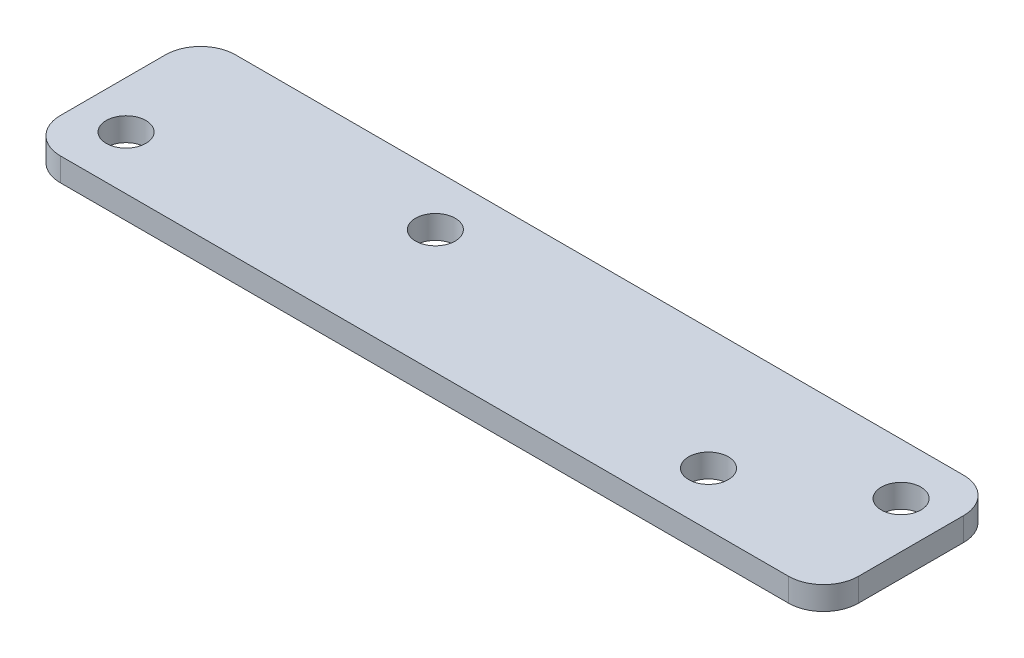
from build123d import *

# Parameters (mm, degrees)
SKETCH_1_R      = 1.7
EXTRUDE_1_DEPTH = 2


with BuildPart() as part:
    # 草图1 → 凸台-拉伸1 (new body)
    with BuildSketch(Plane(origin=(0, 0, 0), x_dir=(1, 0, 0), z_dir=(0, 1, 0))):
        with BuildLine():
            Line((-107.557379254, -1.346413842), (-45.180272198, -1.346413842))
            ThreePointArc((-45.180272198, -1.346413842), (-43.058951854, -2.225093498), (-42.180272198, -4.346413842))
            Line((-42.180272198, -4.346413842), (-42.180272198, -13.346413842))
            ThreePointArc((-42.180272198, -13.346413842), (-43.058951854, -15.467734186), (-45.180272198, -16.346413842))
            Line((-45.180272198, -16.346413842), (-107.557379254, -16.346413842))
            ThreePointArc((-107.557379254, -16.346413842), (-109.678699598, -15.467734186), (-110.557379254, -13.346413842))
            Line((-110.557379254, -13.346413842), (-110.557379254, -4.346413842))
            ThreePointArc((-110.557379254, -4.346413842), (-109.678699598, -2.225093498), (-107.557379254, -1.346413842))
        make_face()
        with Locations(Location((-86.022840673, -5.757384253, 0), (0, 0, 270))):
            Circle(SKETCH_1_R, mode=Mode.SUBTRACT)
        with Locations(Location((-46.122840673, -5.757384253, 0), (0, 0, 270))):
            Circle(SKETCH_1_R, mode=Mode.SUBTRACT)
        with Locations(Location((-106.522840673, -11.757384253, 0), (0, 0, 270))):
            Circle(SKETCH_1_R, mode=Mode.SUBTRACT)
        with Locations(Location((-56.622840673, -11.757384253, 0), (0, 0, 270))):
            Circle(SKETCH_1_R, mode=Mode.SUBTRACT)
    extrude(amount=EXTRUDE_1_DEPTH)


solid = part.part
